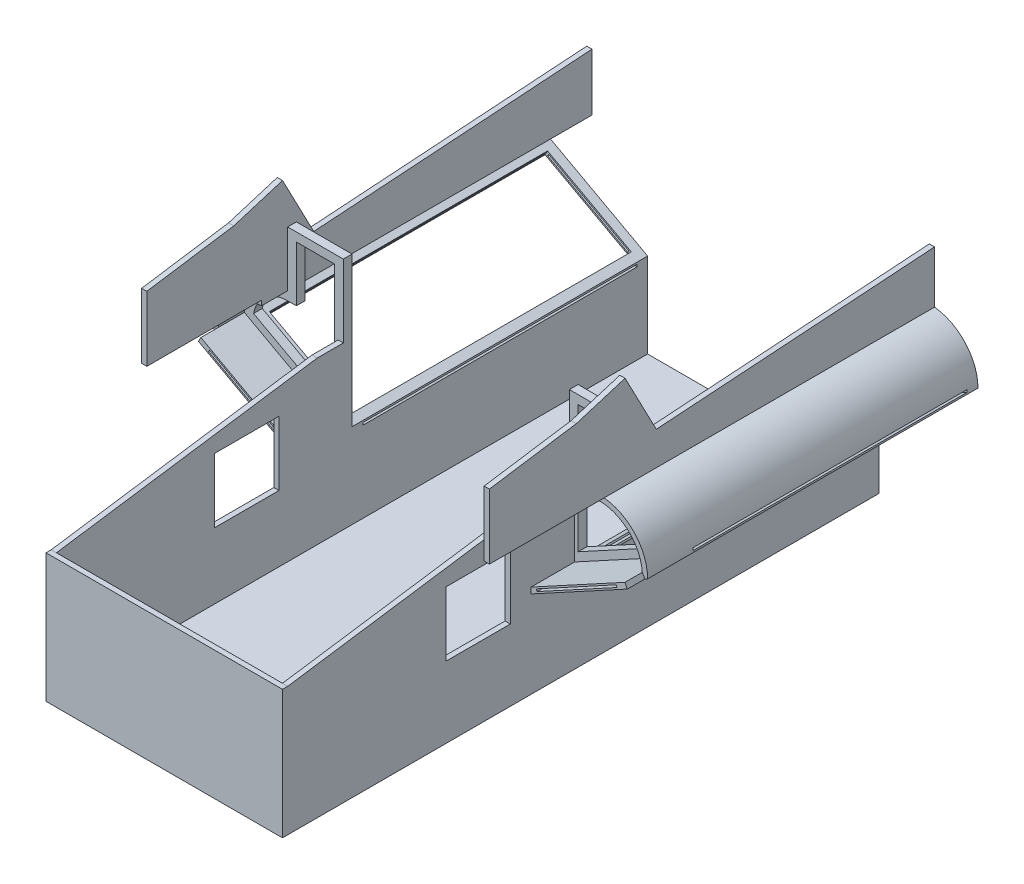
from build123d import *

# Parameters (mm, degrees)
BOSS_EXTRUDE1_DEPTH  = 950
CUT_EXTRUDE1_REACH   = 1533.987
BOSS_EXTRUDE2_REACH  = 1533.987
SKETCH4_W            = 970
SKETCH4_H            = 267.941802888
CUT_EXTRUDE2_DEPTH   = 480
BOSS_EXTRUDE4_DEPTH  = 50
SKETCH14_W           = 25
SKETCH14_H           = 138.177258536
BOSS_EXTRUDE9_DEPTH  = 25
BOSS_EXTRUDE10_START = -25
BOSS_EXTRUDE10_DEPTH = 25
BOSS_EXTRUDE11_DEPTH = 25
BOSS_EXTRUDE12_DEPTH = 25
SKETCH18_W           = 160
SKETCH18_H           = 25
BOSS_EXTRUDE13_DEPTH = 25
SKETCH19_W           = 274.073507304
SKETCH19_H           = 800
CUT_EXTRUDE3_DEPTH   = 25
CUT_EXTRUDE4_DEPTH   = 1168.808883951
CUT_EXTRUDE5_START   = -45
SKETCH22_W           = 788
SKETCH22_H           = 6
CUT_EXTRUDE5_DEPTH   = 350
BOSS_EXTRUDE14_DEPTH = 15
SKETCH24_W           = 650
SKETCH24_H           = 750
BOSS_EXTRUDE15_DEPTH = 15
SKETCH25_W           = 680
SKETCH25_H           = 370
BOSS_EXTRUDE16_DEPTH = 15
CUT_EXTRUDE6_REACH   = 2042.828
SKETCH26_W           = 185
SKETCH26_H           = 185


with BuildPart() as part:
    # Sketch1 → Boss-Extrude1 (new body)
    with BuildSketch(Plane.XY):
        with BuildLine():
            Line((-625, 133.722285201), (-340, -21.277714799))
            Line((-340, -21.277714799), (-340, -271.277714799))
            Line((-340, -271.277714799), (340, -271.277714799))
            Line((340, -271.277714799), (340, -21.277714799))
            Line((340, -21.277714799), (625, 133.722285201))
            ThreePointArc((625, 133.722285201), (589.16333328, 227.263719871), (500, 272.916394272))
            Line((500, 272.916394272), (500, 422.916394272))
            Line((500, 422.916394272), (485, 422.916394272))
            Line((485, 422.916394272), (485, 407.916394272))
            Line((485, 407.916394272), (485, 258.722285201))
            ThreePointArc((485, 258.722285201), (570.238559505, 225.151973889), (609.693359356, 142.472492778))
            Line((609.693359356, 142.472492778), (325, -12.360737749))
            Line((325, -12.360737749), (325, -256.277714799))
            Line((325, -256.277714799), (-325, -256.277714799))
            Line((-325, -256.277714799), (-325, -12.360737749))
            Line((-325, -12.360737749), (-609.693359356, 142.472492778))
            ThreePointArc((-609.693359356, 142.472492778), (-570.238559505, 225.151973889), (-485, 258.722285201))
            Line((-485, 258.722285201), (-485, 407.916394272))
            Line((-485, 407.916394272), (-485, 422.916394272))
            Line((-485, 422.916394272), (-500, 422.916394272))
            Line((-500, 422.916394272), (-500, 272.916394272))
            ThreePointArc((-500, 272.916394272), (-589.16333328, 227.263719871), (-625, 133.722285201))
        make_face()
    extrude(amount=BOSS_EXTRUDE1_DEPTH)

    # Cut-Extrude1: up to this face of the body (flat: up to its plane)
    cut_extrude1_end = Plane(part.part.faces().sort_by_distance((-500, 347.916394272, 475))[0])
    # Sketch2 → Cut-Extrude1 (cut, up to the picked face)
    with BuildSketch(Plane(origin=(500, 0, 0), x_dir=(0, 0, -1), z_dir=(1, 0, 0)), mode=Mode.PRIVATE) as cut_extrude1_sk1:
        Polygon((-950, 358.722285201), (0, 422.916394272), (-950, 422.916394272), align=None)
    cut_extrude1_tool1 = split(extrude(cut_extrude1_sk1.sketch, amount=-CUT_EXTRUDE1_REACH, mode=Mode.PRIVATE), bisect_by=cut_extrude1_end, keep=Keep.BOTH, mode=Mode.PRIVATE)
    add(cut_extrude1_tool1.solids().sort_by(Axis((500, 401.518358, 633.333333), (-1, 0, 0)))[0], mode=Mode.SUBTRACT)

    # Boss-Extrude2: up to this face of the body (flat: up to its plane)
    boss_extrude2_end = Plane(part.part.faces().sort_by_distance((500, 333.324179095, 431.896465862))[0])
    # Sketch3 → Boss-Extrude2 (add, up to the picked face)
    with BuildSketch(Plane.ZY.offset(500), mode=Mode.PRIVATE) as boss_extrude2_sk1:
        Polygon((800, 368.85819716), (890, 540.85819716), (1030, 497.85819716), (1280, 459.85819716), (1280, 272.916394272), (800, 272.916394272), align=None)
    boss_extrude2_tool1 = split(extrude(boss_extrude2_sk1.sketch, amount=-BOSS_EXTRUDE2_REACH, mode=Mode.PRIVATE), bisect_by=boss_extrude2_end, keep=Keep.BOTH, mode=Mode.PRIVATE)
    add(boss_extrude2_tool1.solids().sort_by(Axis((-500, 382.129187, 1038.198063), (1, 0, 0)))[0])

    # Sketch4 → Cut-Extrude2 (cut)
    with BuildSketch(Plane.XY.offset(1280)):
        with Locations((0, 406.887295716)):
            Rectangle(SKETCH4_W, SKETCH4_H)
    extrude(amount=-CUT_EXTRUDE2_DEPTH, mode=Mode.SUBTRACT)

    # Sketch9 → Boss-Extrude4 (add)
    with BuildSketch(Plane.XY.offset(950)):
        Polygon((-609.693359356, 142.472492778), (-616.859938559, 129.295234242), (-340, -21.277714799), (-332.833420796, -8.100456263), align=None)
    boss_extrude4 = extrude(amount=BOSS_EXTRUDE4_DEPTH)

    # Sketch14 → Boss-Extrude9 (add)
    with BuildSketch(Plane(origin=(-485, 0, 0), x_dir=(0, 0, -1), z_dir=(1, 0, 0))):
        with Locations((-862.5, 327.810914469)):
            Rectangle(SKETCH14_W, SKETCH14_H)
    boss_extrude9 = extrude(amount=BOSS_EXTRUDE9_DEPTH)

    # Sketch15 → Boss-Extrude10 (add)
    with BuildSketch(Plane.XY.offset(875).offset(BOSS_EXTRUDE10_START)):
        with BuildLine():
            Line((-460, 258.722285201), (-460, 233.722285201))
            Line((-460, 233.722285201), (-485, 233.722285201))
            ThreePointArc((-485, 233.722285201), (-555.050087415, 205.087439536), (-584.98270599, 135.581990265))
            Line((-584.98270599, 135.581990265), (-587.731261796, 130.528194105))
            Line((-587.731261796, 130.528194105), (-609.693359356, 142.472492778))
            ThreePointArc((-609.693359356, 142.472492778), (-570.238559505, 225.151973889), (-485, 258.722285201))
            Line((-485, 258.722285201), (-460, 258.722285201))
        make_face()
    boss_extrude10 = extrude(amount=BOSS_EXTRUDE10_DEPTH)

    # Sketch16 → Boss-Extrude11 (add)
    with BuildSketch(Plane.XY.offset(875)):
        Polygon((-587.731261796, 130.528194105), (-325, -12.360737749), (-325, 12.639262251), (-583.120237767, 153.020444195), align=None)
    boss_extrude11 = extrude(amount=-BOSS_EXTRUDE11_DEPTH)

    # Sketch17 → Boss-Extrude12 (add)
    with BuildSketch(Plane.XY.offset(875)):
        Polygon((-325, 12.639262251), (-325, 392.639262251), (-350, 392.639262251), (-350, 26.23575348), align=None)
    boss_extrude12 = extrude(amount=-BOSS_EXTRUDE12_DEPTH)

    # Sketch18 → Boss-Extrude13 (add)
    with BuildSketch(Plane.XY.offset(875)):
        with Locations((-405, 405.139262251)):
            Rectangle(SKETCH18_W, SKETCH18_H)
    boss_extrude13 = extrude(amount=-BOSS_EXTRUDE13_DEPTH)

    # Sketch19 → Cut-Extrude3 (cut)
    with BuildSketch(Plane(origin=(-79.374447411, -145.946564595, 0), x_dir=(0.8784839023828743, -0.47777194690998404, 0), z_dir=(0.47777194690998404, 0.8784839023828743, 0))):
        with Locations((-441.638408187, -425)):
            Rectangle(SKETCH19_W, SKETCH19_H)
    cut_extrude3 = extrude(amount=-CUT_EXTRUDE3_DEPTH, mode=Mode.SUBTRACT)

    # Sketch21 → Cut-Extrude4 (cut, symmetric)
    with BuildSketch(Plane(origin=(0, 0, 825), x_dir=(-1, 0, 0), z_dir=(0, 0, -1))):
        Polygon((584.610332143, 123.708384863), (354.382974735, -1.502984955), (357.249606416, -6.773888369), (587.476963824, 118.437481449), align=None)
    cut_extrude4 = extrude(amount=CUT_EXTRUDE4_DEPTH, both=True, mode=Mode.SUBTRACT)

    # Sketch22 → Cut-Extrude5 (cut)
    with BuildSketch(Plane(origin=(-508.356814385, 276.4747587, 0), x_dir=(0, 0, -1), z_dir=(0.8784839023828743, -0.477771946909984, 0)).offset(CUT_EXTRUDE5_START)):
        with Locations((-425, -173.634591879)):
            Rectangle(SKETCH22_W, SKETCH22_H)
    cut_extrude5 = extrude(amount=CUT_EXTRUDE5_DEPTH, mode=Mode.SUBTRACT)

    # Mirror1: Boss-Extrude4, Boss-Extrude9, Boss-Extrude10, Boss-Extrude11, Boss-Extrude12, Boss-Extrude13, Cut-Extrude3, Cut-Extrude4, Cut-Extrude5 across plane
    add(boss_extrude4.mirror(Plane(origin=(0, 0, 0), x_dir=(0, 0, 1), z_dir=(1, 0, 0))))
    add(boss_extrude9.mirror(Plane(origin=(0, 0, 0), x_dir=(0, 0, 1), z_dir=(1, 0, 0))))
    add(boss_extrude10.mirror(Plane(origin=(0, 0, 0), x_dir=(0, 0, 1), z_dir=(1, 0, 0))))
    add(boss_extrude11.mirror(Plane(origin=(0, 0, 0), x_dir=(0, 0, 1), z_dir=(1, 0, 0))))
    add(boss_extrude12.mirror(Plane(origin=(0, 0, 0), x_dir=(0, 0, 1), z_dir=(1, 0, 0))))
    add(boss_extrude13.mirror(Plane(origin=(0, 0, 0), x_dir=(0, 0, 1), z_dir=(1, 0, 0))))
    add(cut_extrude3.mirror(Plane(origin=(0, 0, 0), x_dir=(0, 0, 1), z_dir=(1, 0, 0))), mode=Mode.SUBTRACT)
    add(cut_extrude4.mirror(Plane(origin=(0, 0, 0), x_dir=(0, 0, 1), z_dir=(1, 0, 0))), mode=Mode.SUBTRACT)
    add(cut_extrude5.mirror(Plane(origin=(0, 0, 0), x_dir=(0, 0, 1), z_dir=(1, 0, 0))), mode=Mode.SUBTRACT)

    # Sketch23 → Boss-Extrude14 (add)
    with BuildSketch(Plane.ZY.offset(340)):
        Polygon((950, -271.277714799), (1700, -271.277714799), (1700, 98.722285201), (950, 208.722285201), (873.5, 208.722285201), (873.5, -21.277714799), (950, -21.277714799), align=None)
    boss_extrude14 = extrude(amount=-BOSS_EXTRUDE14_DEPTH)

    # Mirror2: Boss-Extrude14 across plane
    add(boss_extrude14.mirror(Plane(origin=(0, 0, 0), x_dir=(0, 0, 1), z_dir=(1, 0, 0))))

    # Sketch24 → Boss-Extrude15 (add)
    with BuildSketch(Plane(origin=(0, -256.277714799, 0), x_dir=(1, 0, 0), z_dir=(0, 1, 0))):
        with Locations((0, -1325)):
            Rectangle(SKETCH24_W, SKETCH24_H)
    extrude(amount=-BOSS_EXTRUDE15_DEPTH)

    # Sketch25 → Boss-Extrude16 (add)
    with BuildSketch(Plane.XY.offset(1700)):
        with Locations((0, -86.277714799)):
            Rectangle(SKETCH25_W, SKETCH25_H)
    extrude(amount=BOSS_EXTRUDE16_DEPTH)

    # Cut-Extrude6: up to this face of the body (flat: up to its plane)
    cut_extrude6_end = Plane(part.part.faces().sort_by_distance((-340, -90.018652178, 958.920592754))[0])
    # Sketch26 → Cut-Extrude6 (cut, up to the picked face)
    with BuildSketch(Plane(origin=(340, 0, 0), x_dir=(0, 0, -1), z_dir=(1, 0, 0)), mode=Mode.PRIVATE) as cut_extrude6_sk1:
        with Locations((-1152.5, 26.222285201)):
            Rectangle(SKETCH26_W, SKETCH26_H)
    cut_extrude6_tool1 = split(extrude(cut_extrude6_sk1.sketch, amount=-CUT_EXTRUDE6_REACH, mode=Mode.PRIVATE), bisect_by=cut_extrude6_end, keep=Keep.BOTH, mode=Mode.PRIVATE)
    add(cut_extrude6_tool1.solids().sort_by(Axis((340, 26.222285, 1152.5), (-1, 0, 0)))[0], mode=Mode.SUBTRACT)


solid = part.part
